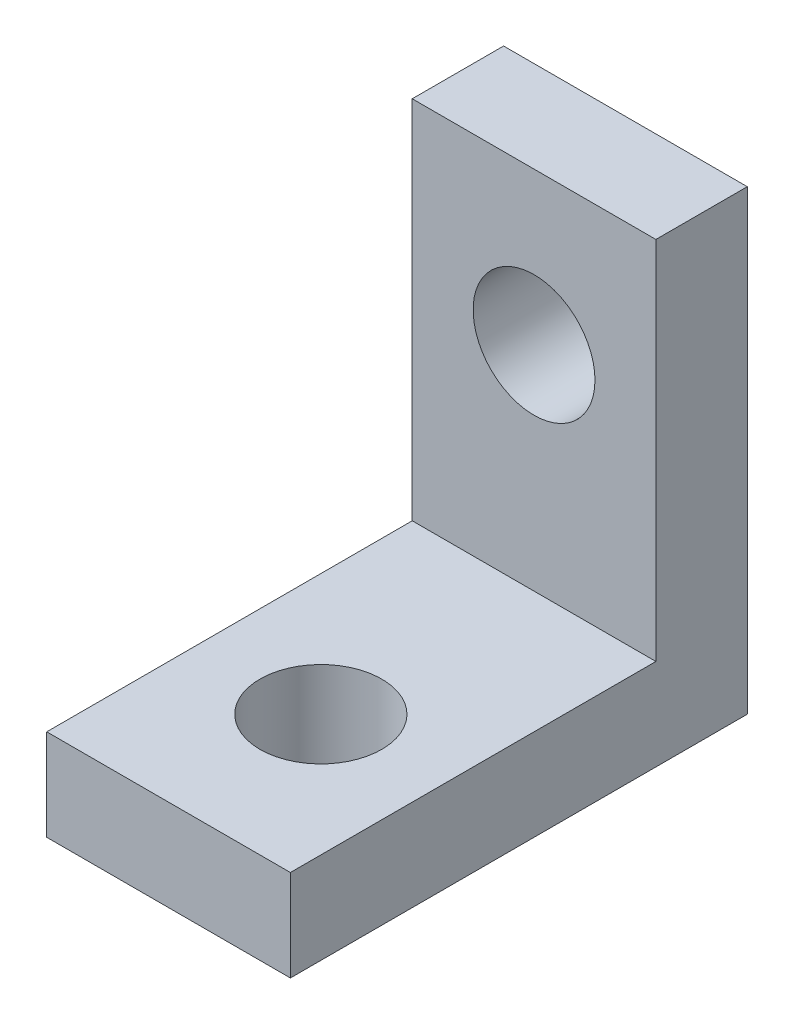
from build123d import *

# Parameters (mm, degrees)
ESQUISSE1_W             = 8
ESQUISSE1_H             = 3
BOSS_EXTRU_1_DEPTH      = 15
ESQUISSE2_W             = 8
ESQUISSE2_H             = 3
BOSS_EXTRU_2_DEPTH      = 12
ESQUISSE3_R             = 2
ENL_V_MAT_EXTRU_1_DEPTH = 20.62141687
ESQUISSE4_R             = 2
ENL_V_MAT_EXTRU_2_DEPTH = 19.5


with BuildPart() as part:
    # Esquisse1 → Boss.-Extru.1 (new body)
    with BuildSketch(Plane.XY):
        Rectangle(ESQUISSE1_W, ESQUISSE1_H)
    extrude(amount=BOSS_EXTRU_1_DEPTH)

    # Esquisse2 → Boss.-Extru.2 (add)
    with BuildSketch(Plane(origin=(0, 1.5, 0), x_dir=(1, 0, 0), z_dir=(0, 1, 0))):
        with Locations((0, -1.5)):
            Rectangle(ESQUISSE2_W, ESQUISSE2_H)
    extrude(amount=BOSS_EXTRU_2_DEPTH)

    # Esquisse3 → Enlèv. mat.-Extru.1 (cut, through all)
    with BuildSketch(Plane(origin=(0, 1.5, 0), x_dir=(1, 0, 0), z_dir=(0, 1, 0))):
        with Locations(Location((0, -10, 0), (0, 0, 270))):
            Circle(ESQUISSE3_R)
    extrude(amount=-ENL_V_MAT_EXTRU_1_DEPTH, mode=Mode.SUBTRACT)

    # Esquisse4 → Enlèv. mat.-Extru.2 (cut, through all)
    with BuildSketch(Plane.XY.offset(3)):
        with Locations((0, 8.5)):
            Circle(ESQUISSE4_R)
    extrude(amount=-ENL_V_MAT_EXTRU_2_DEPTH, mode=Mode.SUBTRACT)


solid = part.part
